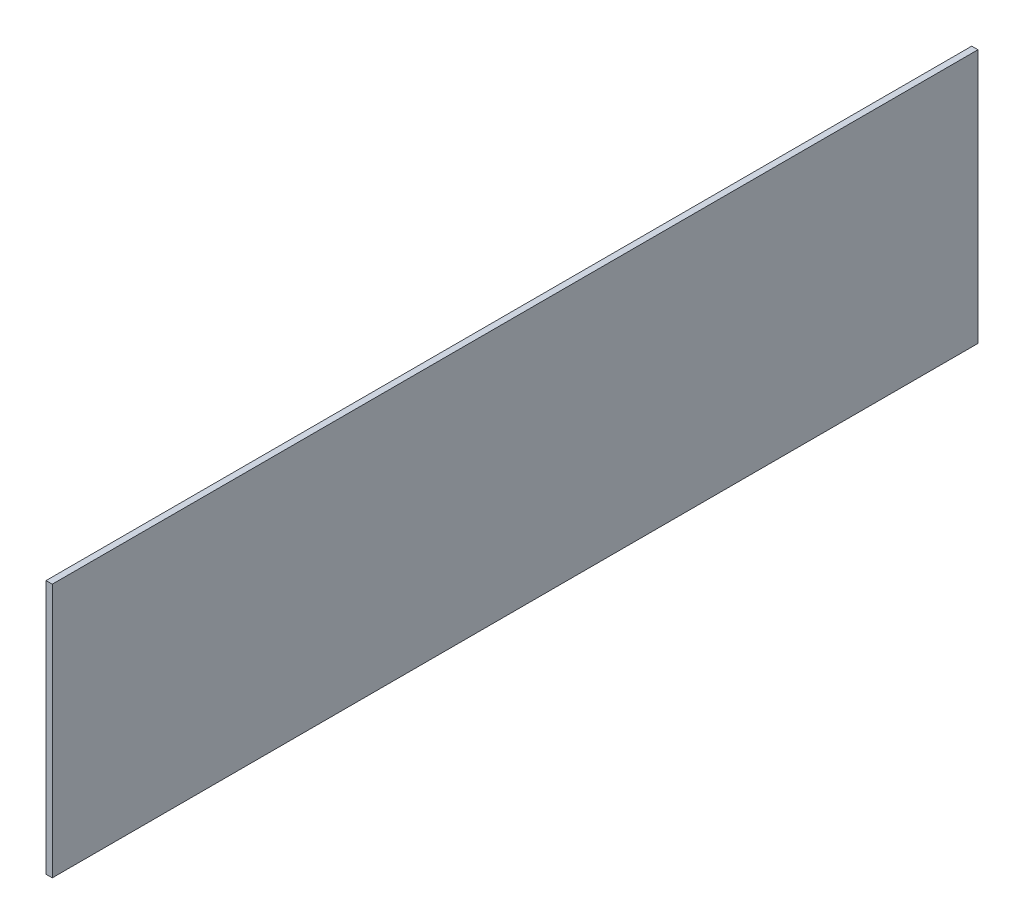
from build123d import *

# Parameters (mm, degrees)
SKETCH1_W           = 12
SKETCH1_H           = 488
BOSS_EXTRUDE1_DEPTH = 1776


with BuildPart() as part:
    # Sketch1 → Boss-Extrude1 (new body)
    with BuildSketch(Plane.XY):
        with Locations((-75.230769231, -85.230769231)):
            Rectangle(SKETCH1_W, SKETCH1_H)
    extrude(amount=BOSS_EXTRUDE1_DEPTH)


solid = part.part
